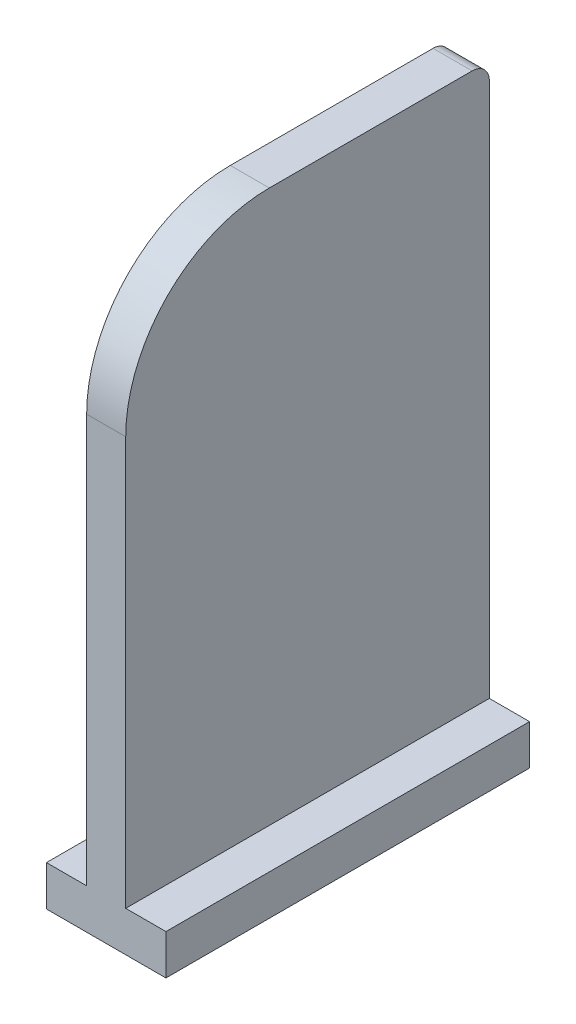
from build123d import *

# Parameters (mm, degrees)
BOSS_EXTRUDE1_DEPTH = 63.3
FILLET4_R           = 3
FILLET5_R           = 25


with BuildPart() as part:
    # Sketch1 → Boss-Extrude1 (new body)
    with BuildSketch(Plane.XY):
        Polygon((0, 7), (7, 7), (7, 18.10712891), (7, 103.1), (13.8, 103.1), (13.8, 18.10712891), (13.8, 7), (20.8, 7), (20.8, 0), (0, 0), align=None)
    extrude(amount=BOSS_EXTRUDE1_DEPTH)

    # Fillet4
    fillet4_edges = [part.edges().sort_by_distance(p)[0] for p in [
        (10.4, 103.1, 0),
    ]]
    fillet(fillet4_edges, radius=FILLET4_R)

    # Fillet5
    fillet5_edges = [part.edges().sort_by_distance(p)[0] for p in [
        (10.4, 103.1, 63.3),
    ]]
    fillet(fillet5_edges, radius=FILLET5_R)


solid = part.part
